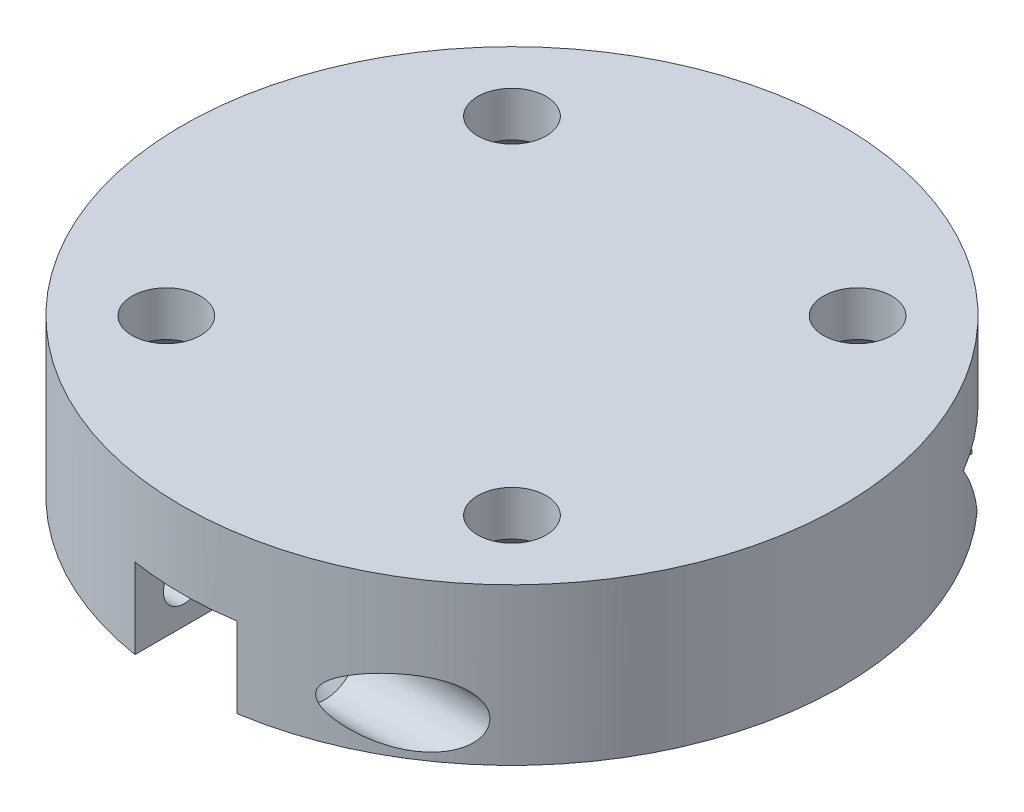
from build123d import *
from build123d.topology import SkipClean

# Parameters (mm, degrees)
SKETCH63_R                                           = 33.71
BOSS_EXTRUDE14_DEPTH                                 = 30
CUT_EXTRUDE16_START                                  = -1.56
CUT_EXTRUDE16_DEPTH                                  = 55.766975775
CUT_EXTRUDE17_DEPTH                                  = 57.326975775
CUT_EXTRUDE17_DEPTH_BACK                             = 57.326975775
BOSS_EXTRUDE15_DEPTH                                 = 12
CUT_EXTRUDE18_START                                  = -5.22
SKETCH69_R                                           = 2.1
CUT_EXTRUDE18_DEPTH                                  = 6
SKETCH70_R                                           = 3.36
SKETCH70_R_2                                         = 2.1
CUT_EXTRUDE19_DEPTH                                  = 63.259333256
CSK_FOR_M3_HEX_SOCKET_COUNTERSUNK_CAP_SC_D           = 3.6
CSK_FOR_M3_HEX_SOCKET_COUNTERSUNK_CAP_SC_DEPTH       = 14.440351168
CSK_FOR_M3_HEX_SOCKET_COUNTERSUNK_CAP_SC_CSINK_D     = 6.72
CSK_FOR_M3_HEX_SOCKET_COUNTERSUNK_CAP_SC_CSINK_ANGLE = 90
CSK_FOR_M3_HEX_SOCKET_COUNTERSUNK_CAP_SC_TIP         = 1.081549114
SKETCH74_R                                           = 44.614790837
CUT_EXTRUDE20_DEPTH                                  = 14
CSK_FOR_M6_HEX_SOCKET_COUNTERSUNK_CA_2_COUNT         = 2
CSK_FOR_M6_HEX_SOCKET_COUNTERSUNK_CA_2_PITCH         = 35.355339059
CSK_FOR_M6_HEX_SOCKET_COUNTERSUNK_CA_3_COUNT         = 2
CSK_FOR_M6_HEX_SOCKET_COUNTERSUNK_CA_3_PITCH         = 35.355339059
CSK_FOR_M6_HEX_SOCKET_COUNTERSUNK_CA_4_COUNT         = 2
CSK_FOR_M6_HEX_SOCKET_COUNTERSUNK_CA_4_PITCH         = 50
SKETCH79_R                                           = 6.72
CUT_EXTRUDE21_DEPTH                                  = 15


with BuildPart() as part:
    # Sketch63 → Boss-Extrude14 (new body)
    with BuildSketch(Plane(origin=(0, 0, 0), x_dir=(1, 0, 0), z_dir=(0, 1, 0))):
        with Locations(Location((0, 0, 0), (0, 0, 270))):
            Circle(SKETCH63_R)
    extrude(amount=BOSS_EXTRUDE14_DEPTH)

    # Sketch67 → Cut-Extrude16 (cut, through all)
    with BuildSketch(Plane.XY.offset(CUT_EXTRUDE16_START)):
        Polygon((-25.257756337, 0), (-19.816405169, 0), (-15.992682372, 8.2), (-29.081479134, 8.2), align=None)
        Polygon((19.742243663, 0), (25.183594831, 0), (29.007317628, 8.2), (15.918520866, 8.2), align=None)
    extrude(amount=-CUT_EXTRUDE16_DEPTH, mode=Mode.SUBTRACT)

    # Sketch67<3> → Cut-Extrude17 (cut, two sides: drawn at the far end of the back side and taken through both)
    with BuildSketch(Plane.XY.offset(-CUT_EXTRUDE17_DEPTH_BACK)):
        Polygon((-5.257756337, 0), (5.183594831, 0), (9.007317628, 8.2), (-9.081479134, 8.2), align=None)
    extrude(amount=CUT_EXTRUDE17_DEPTH + CUT_EXTRUDE17_DEPTH_BACK, mode=Mode.SUBTRACT)

    # Sketch68 → Boss-Extrude15 (add)
    with SkipClean():  # the faces are left unmerged after this step: merging them gives an invalid solid
        with BuildSketch(Plane.XZ):
            with BuildLine():
                Line((-5.257756337, 21.297448826), (-5.257756337, 33.297448826))
                ThreePointArc((-5.257756337, 33.297448826), (-12.10394362, 31.462019148), (-18.415011022, 28.235641821))
                Line((-18.415011022, 28.235641821), (-18.415011022, 21.297448826))
                Line((-18.415011022, 21.297448826), (-5.257756337, 21.297448826))
            make_face()
            with BuildLine():
                ThreePointArc((15.05537339, 30.161230613), (10.24115174, 32.116707662), (5.183594831, 33.309074509))
                Line((5.183594831, 33.309074509), (5.183594831, 21.297448826))
                Line((5.183594831, 21.297448826), (15.05537339, 21.297448826))
                Line((15.05537339, 21.297448826), (15.05537339, 30.161230613))
            make_face()
        extrude(amount=-BOSS_EXTRUDE15_DEPTH)

    # Sketch69 → Cut-Extrude18 (cut)
    with SkipClean():  # the faces are left unmerged after this step: merging them gives an invalid solid
        with BuildSketch(Plane(origin=(-0.037756337, 0, 0), x_dir=(0, 0, -1), z_dir=(1, 0, 0)).offset(CUT_EXTRUDE18_START)):
            with Locations((-28.297448826, 4.1)):
                Circle(SKETCH69_R)
        extrude(amount=-CUT_EXTRUDE18_DEPTH, mode=Mode.SUBTRACT)

    # Sketch70 → Cut-Extrude19 (cut, through all)
    # profile 1 of 2: a face of its own
    with SkipClean():  # the faces are left unmerged after this step: merging them gives an invalid solid
        with BuildSketch(Plane.ZY.offset(-9.183594831)):
            with Locations((28.297448826, 4.1)):
                Circle(SKETCH70_R)
            with Locations(Location((28.297448826, 4.1, 0), (0, 0, 180))):
                Circle(SKETCH70_R_2, mode=Mode.SUBTRACT)
        # profile 2 of 2: a face of its own
        with BuildSketch(Plane.ZY.offset(-9.183594831)):
            with Locations(Location((28.297448826, 4.1, 0), (0, 0, 180))):
                Circle(SKETCH70_R_2)
        extrude(amount=-CUT_EXTRUDE19_DEPTH, mode=Mode.SUBTRACT)

    # CSK for M3 Hex Socket Countersunk Cap Screw9
    with Locations(Plane(origin=(9.183594831, 0, 0), x_dir=(0, 0, -1), z_dir=(1, 0, 0))):
        with Locations((-28.297448826, 4.1)):
            CounterSinkHole(CSK_FOR_M3_HEX_SOCKET_COUNTERSUNK_CAP_SC_D / 2, CSK_FOR_M3_HEX_SOCKET_COUNTERSUNK_CAP_SC_CSINK_D / 2, depth=CSK_FOR_M3_HEX_SOCKET_COUNTERSUNK_CAP_SC_DEPTH, counter_sink_angle=CSK_FOR_M3_HEX_SOCKET_COUNTERSUNK_CAP_SC_CSINK_ANGLE)
            with Locations((0, 0, -(CSK_FOR_M3_HEX_SOCKET_COUNTERSUNK_CAP_SC_DEPTH + CSK_FOR_M3_HEX_SOCKET_COUNTERSUNK_CAP_SC_TIP / 2))):  # 118° drill point
                Cone(0, CSK_FOR_M3_HEX_SOCKET_COUNTERSUNK_CAP_SC_D / 2, CSK_FOR_M3_HEX_SOCKET_COUNTERSUNK_CAP_SC_TIP, mode=Mode.SUBTRACT)

    # Sketch74 → Cut-Extrude20 (cut)
    with SkipClean():  # the faces are left unmerged after this step: merging them gives an invalid solid
        with BuildSketch(Plane(origin=(0, 30, 0), x_dir=(1, 0, 0), z_dir=(0, 1, 0))):
            Circle(SKETCH74_R)
        extrude(amount=-CUT_EXTRUDE20_DEPTH, mode=Mode.SUBTRACT)

    # Sketch78 → CSK for M6 Hex Socket Countersunk Cap Screw4 (revolve, cut)
    with SkipClean():  # the faces are left unmerged after this step: merging them gives an invalid solid
        with BuildSketch(Plane(origin=(-17.67766953, 8.2, 17.67766953), x_dir=(0, 0, -1), z_dir=(1, 0, 0))):
            Polygon((0, 0), (0, 16.543012167), (3.5, 14.44), (3.5, 3.22), (6.72, 0), align=None)
        csk_for_m6_hex_socket_countersunk_cap_sc = revolve(axis=Axis((-17.67766953, 1.85, 17.67766953), (0, 1, 0)), mode=Mode.SUBTRACT)

    # CSK for M6 Hex Socket Countersunk Ca 2: CSK for M6 Hex Socket Countersunk Cap Screw4 ×2
    with SkipClean():  # the faces are left unmerged after this step: merging them gives an invalid solid
        with Locations(*[(i * CSK_FOR_M6_HEX_SOCKET_COUNTERSUNK_CA_2_PITCH, 0, 0) for i in range(1, CSK_FOR_M6_HEX_SOCKET_COUNTERSUNK_CA_2_COUNT)]):
            add(csk_for_m6_hex_socket_countersunk_cap_sc, mode=Mode.SUBTRACT)

    # CSK for M6 Hex Socket Countersunk Ca 3: CSK for M6 Hex Socket Countersunk Cap Screw4 ×2
    with SkipClean():  # the faces are left unmerged after this step: merging them gives an invalid solid
        with Locations(*[(0, 0, -i * CSK_FOR_M6_HEX_SOCKET_COUNTERSUNK_CA_3_PITCH) for i in range(1, CSK_FOR_M6_HEX_SOCKET_COUNTERSUNK_CA_3_COUNT)]):
            add(csk_for_m6_hex_socket_countersunk_cap_sc, mode=Mode.SUBTRACT)

    # CSK for M6 Hex Socket Countersunk Ca 4: CSK for M6 Hex Socket Countersunk Cap Screw4 ×2
    with SkipClean():  # the faces are left unmerged after this step: merging them gives an invalid solid
        with Locations(*[Vector(0.7071067811865438, 0, -0.7071067811865512) * (i * CSK_FOR_M6_HEX_SOCKET_COUNTERSUNK_CA_4_PITCH) for i in range(1, CSK_FOR_M6_HEX_SOCKET_COUNTERSUNK_CA_4_COUNT)]):
            add(csk_for_m6_hex_socket_countersunk_cap_sc, mode=Mode.SUBTRACT)

    # Sketch79 → Cut-Extrude21 (cut)
    with SkipClean():  # the faces are left unmerged after this step: merging them gives an invalid solid
        with BuildSketch(Plane.XZ.offset(-8.2)):
            with Locations((-17.67766953, -17.67766953)):
                Circle(SKETCH79_R)
            with Locations((17.67766953, -17.67766953)):
                Circle(SKETCH79_R)
            with Locations(Location((17.67766953, 17.67766953, 0), (0, 0, 90))):
                Circle(SKETCH79_R)
            with Locations(Location((-17.67766953, 17.67766953, 0), (0, 0, 90))):
                Circle(SKETCH79_R)
        extrude(amount=CUT_EXTRUDE21_DEPTH, mode=Mode.SUBTRACT)


solid = part.part
